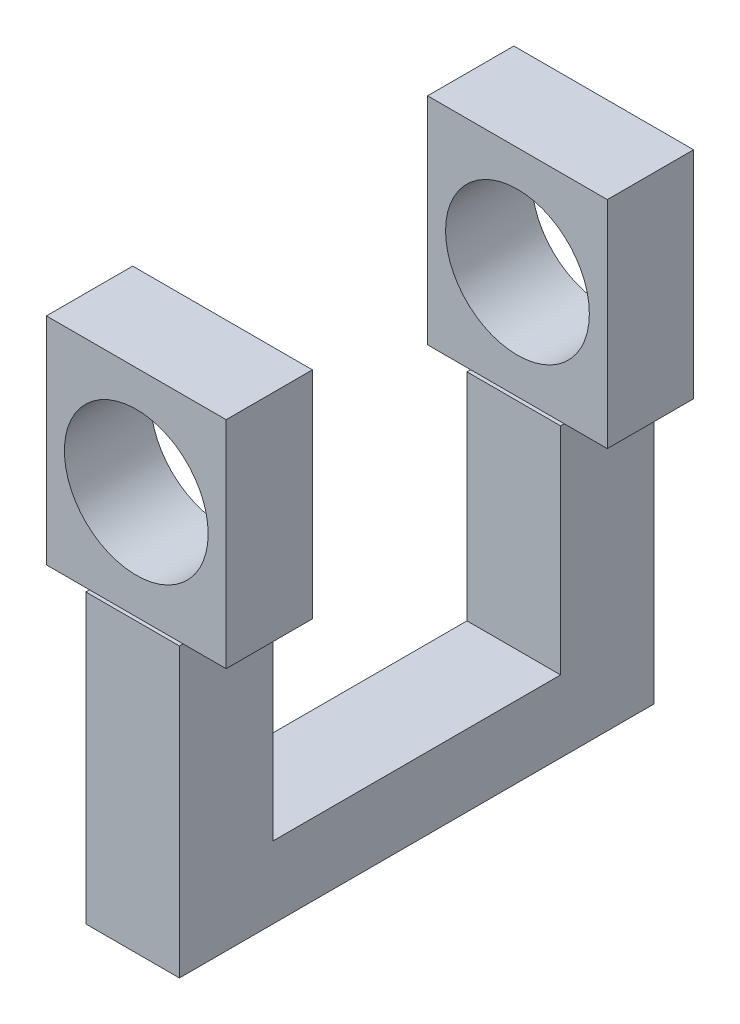
from build123d import *

# Parameters (mm, degrees)
SKETCH1_W                = 13.022
SKETCH1_H                = 40
BOSS_EXTRUDE1_DEPTH      = 10
BOSS_EXTRUDE2_DEPTH      = 30
BOSS_EXTRUDE2_DEPTH_BACK = 10
SKETCH2_W                = 13.022
SKETCH2_H                = 13.022
SKETCH3_W                = 10.902
SKETCH3_H                = 10.902
CUT_EXTRUDE1_DEPTH       = 50
BOSS_EXTRUDE3_START      = 15
SKETCH4_W                = 10.902
SKETCH4_H                = 10.902
BOSS_EXTRUDE3_DEPTH      = 15
SKETCH5_W                = 25
SKETCH5_H                = 12
BOSS_EXTRUDE4_DEPTH      = 30
SKETCH6_R                = 10
CUT_EXTRUDE2_DEPTH       = 100


with BuildPart() as part:
    # Sketch1 → Boss-Extrude1 (new body)
    with BuildSketch(Plane(origin=(0, 0, 0), x_dir=(1, 0, 0), z_dir=(0, 1, 0))):
        with Locations((6.511, 20)):
            Rectangle(SKETCH1_W, SKETCH1_H)
    extrude(amount=BOSS_EXTRUDE1_DEPTH)

    # Sketch2 → Boss-Extrude2 (add, two sides: drawn at the far end of the back side and taken through both)
    with BuildSketch(Plane(origin=(0, 10, 0), x_dir=(1, 0, 0), z_dir=(0, 1, 0)).offset(-BOSS_EXTRUDE2_DEPTH_BACK)):
        with Locations((6.511, 46.511)):
            Rectangle(SKETCH2_W, SKETCH2_H)
        with Locations((6.511, -6.511)):
            Rectangle(SKETCH2_W, SKETCH2_H)
    extrude(amount=BOSS_EXTRUDE2_DEPTH + BOSS_EXTRUDE2_DEPTH_BACK)

    # Sketch3 → Cut-Extrude1 (cut)
    with BuildSketch(Plane(origin=(0, 40, 0), x_dir=(1, 0, 0), z_dir=(0, 1, 0))):
        with Locations((6.511, 46.511)):
            Rectangle(SKETCH3_W, SKETCH3_H)
        with Locations((6.511, -6.511)):
            Rectangle(SKETCH3_W, SKETCH3_H)
    extrude(amount=-CUT_EXTRUDE1_DEPTH, mode=Mode.SUBTRACT)

    # Sketch4 → Boss-Extrude3 (add)
    with BuildSketch(Plane(origin=(0, 10, 0), x_dir=(1, 0, 0), z_dir=(0, 1, 0)).offset(BOSS_EXTRUDE3_START)):
        with Locations((6.511, 46.511)):
            Rectangle(SKETCH4_W, SKETCH4_H)
        with Locations((6.511, -6.511)):
            Rectangle(SKETCH4_W, SKETCH4_H)
    extrude(amount=BOSS_EXTRUDE3_DEPTH)

    # Sketch5 → Boss-Extrude4 (add)
    with BuildSketch(Plane(origin=(0, 40, 0), x_dir=(1, 0, 0), z_dir=(0, 1, 0))):
        with Locations((6.511, 46.511)):
            Rectangle(SKETCH5_W, SKETCH5_H)
        with Locations((6.511, -6.511)):
            Rectangle(SKETCH5_W, SKETCH5_H)
    extrude(amount=BOSS_EXTRUDE4_DEPTH)

    # Sketch6 → Cut-Extrude2 (cut)
    with BuildSketch(Plane.XY.offset(12.511)):
        with Locations((6.511, 55)):
            Circle(SKETCH6_R)
    extrude(amount=-CUT_EXTRUDE2_DEPTH, mode=Mode.SUBTRACT)


solid = part.part
